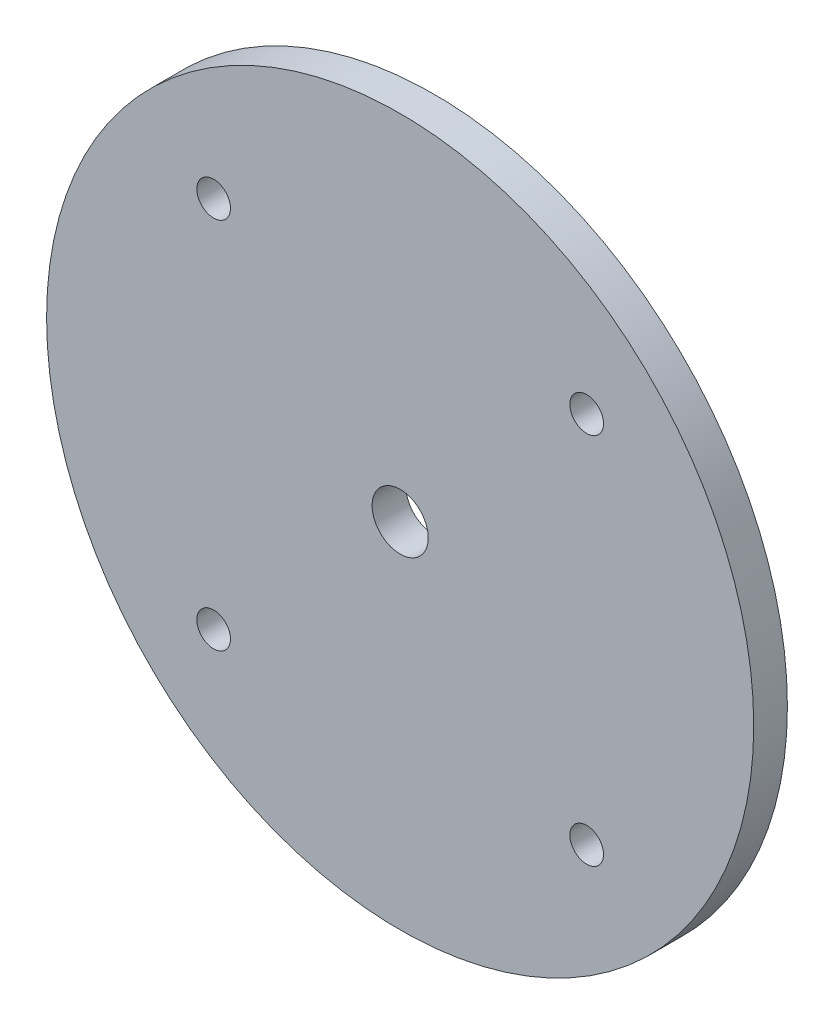
from build123d import *

# Parameters (mm, degrees)
CROQUIS1_R              = 31.5
CROQUIS1_R_2            = 1.5
SALIENTE_EXTRUIR1_DEPTH = 3
CROQUIS4_R              = 2.5
CORTAR_EXTRUIR3_DEPTH   = 3


with BuildPart() as part:
    # Croquis1 → Saliente-Extruir1 (new body)
    with BuildSketch(Plane.XY):
        with Locations((-43.449193048, 8.207110309)):
            Circle(CROQUIS1_R)
        with Locations((-60.066202406, 24.824119667)):
            Circle(CROQUIS1_R_2, mode=Mode.SUBTRACT)
        with Locations((-26.83218369, 24.824119667)):
            Circle(CROQUIS1_R_2, mode=Mode.SUBTRACT)
        with Locations((-26.83218369, -8.409899049)):
            Circle(CROQUIS1_R_2, mode=Mode.SUBTRACT)
        with Locations((-60.066202406, -8.409899049)):
            Circle(CROQUIS1_R_2, mode=Mode.SUBTRACT)
    extrude(amount=SALIENTE_EXTRUIR1_DEPTH)

    # Croquis4 → Cortar-Extruir3 (cut)
    with BuildSketch(Plane(origin=(0, 0, 0), x_dir=(-1, 0, 0), z_dir=(0, 0, -1))):
        with Locations((43.449193048, 8.207110309)):
            Circle(CROQUIS4_R)
    extrude(amount=-CORTAR_EXTRUIR3_DEPTH, mode=Mode.SUBTRACT)


solid = part.part
